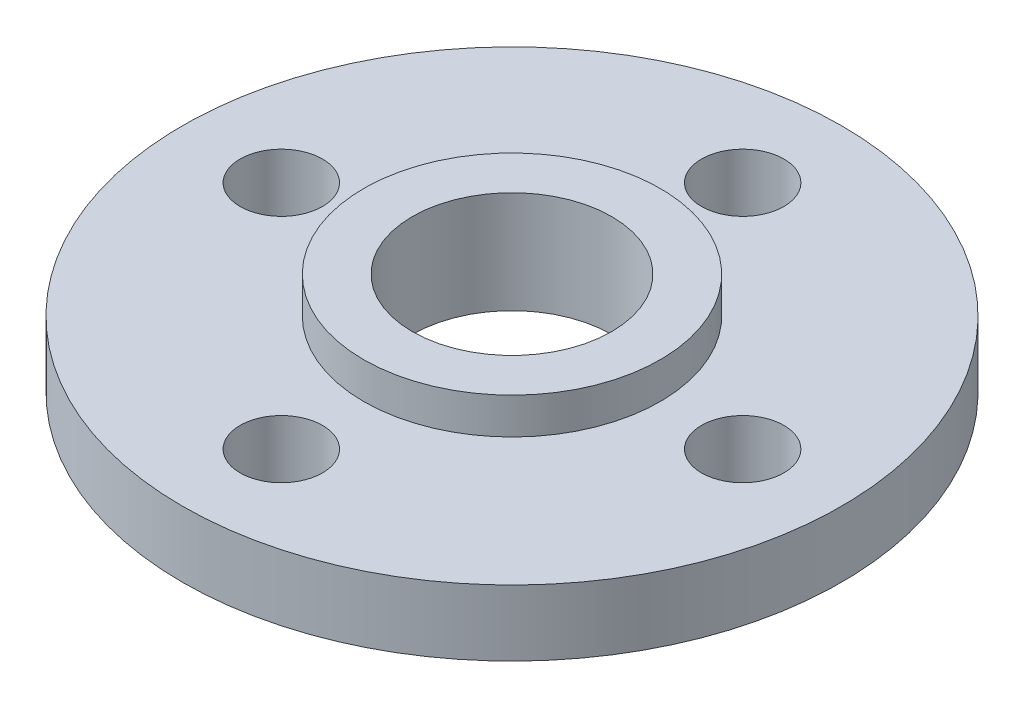
from build123d import *

# Parameters (mm, degrees)
SKETCH_1_R          = 10
EXTRUDE_1_DEPTH     = 2
SKETCH_2_R          = 4.5
EXTRUDE_2_DEPTH     = 1.1
CUT_EXTRUDE_1_REACH = 16.478
SKETCH_3_R          = 3.025
CUT_EXTRUDE_2_REACH = 16.283
SKETCH_4_R          = 1.25


with BuildPart() as part:
    # 草图1 → 凸台-拉伸1 (new body)
    with BuildSketch(Plane(origin=(0, 0, 0), x_dir=(1, 0, 0), z_dir=(0, 1, 0))):
        with Locations(Location((0, 0, 0), (0, 0, 270))):
            Circle(SKETCH_1_R)
    extrude(amount=EXTRUDE_1_DEPTH)

    # 草图2 → 凸台-拉伸2 (add)
    with BuildSketch(Plane(origin=(0, 2, 0), x_dir=(1, 0, 0), z_dir=(0, 1, 0))):
        with Locations(Location((0, 0, 0), (0, 0, 270))):
            Circle(SKETCH_2_R)
    extrude(amount=EXTRUDE_2_DEPTH)

    # 草图3 → 切除-拉伸1 (cut, up to next)
    with BuildSketch(Plane(origin=(0, 3.1, 0), x_dir=(1, 0, 0), z_dir=(0, 1, 0)), mode=Mode.PRIVATE) as cut_extrude_1_sk1:
        with Locations(Location((0, 0, 0), (0, 0, 270))):
            Circle(SKETCH_3_R)
    cut_extrude_1_tool1 = extrude(cut_extrude_1_sk1.sketch, amount=-CUT_EXTRUDE_1_REACH, mode=Mode.PRIVATE) & part.part
    add(cut_extrude_1_tool1.solids().sort_by_distance((0, 3.1, 0))[0], mode=Mode.SUBTRACT)

    # 草图4 → 切除-拉伸2 (cut, up to next)
    with BuildSketch(Plane(origin=(0, 2, 0), x_dir=(1, 0, 0), z_dir=(0, 1, 0)), mode=Mode.PRIVATE) as cut_extrude_2_sk1:
        with Locations(Location((0, 7, 0), (0, 0, 270))):
            Circle(SKETCH_4_R)
    cut_extrude_2_tool1 = extrude(cut_extrude_2_sk1.sketch, amount=-CUT_EXTRUDE_2_REACH, mode=Mode.PRIVATE) & part.part
    # 草图4 → 切除-拉伸2 (cut, up to next)
    with BuildSketch(Plane(origin=(0, 2, 0), x_dir=(1, 0, 0), z_dir=(0, 1, 0)), mode=Mode.PRIVATE) as cut_extrude_2_sk2:
        with Locations(Location((7, 0, 0), (0, 0, 270))):
            Circle(SKETCH_4_R)
    cut_extrude_2_tool2 = extrude(cut_extrude_2_sk2.sketch, amount=-CUT_EXTRUDE_2_REACH, mode=Mode.PRIVATE) & part.part
    # 草图4 → 切除-拉伸2 (cut, up to next)
    with BuildSketch(Plane(origin=(0, 2, 0), x_dir=(1, 0, 0), z_dir=(0, 1, 0)), mode=Mode.PRIVATE) as cut_extrude_2_sk3:
        with Locations(Location((0, -7, 0), (0, 0, 270))):
            Circle(SKETCH_4_R)
    cut_extrude_2_tool3 = extrude(cut_extrude_2_sk3.sketch, amount=-CUT_EXTRUDE_2_REACH, mode=Mode.PRIVATE) & part.part
    # 草图4 → 切除-拉伸2 (cut, up to next)
    with BuildSketch(Plane(origin=(0, 2, 0), x_dir=(1, 0, 0), z_dir=(0, 1, 0)), mode=Mode.PRIVATE) as cut_extrude_2_sk4:
        with Locations(Location((-7, 0, 0), (0, 0, 270))):
            Circle(SKETCH_4_R)
    cut_extrude_2_tool4 = extrude(cut_extrude_2_sk4.sketch, amount=-CUT_EXTRUDE_2_REACH, mode=Mode.PRIVATE) & part.part
    add(cut_extrude_2_tool1.solids().sort_by_distance((0, 2, -7))[0], mode=Mode.SUBTRACT)
    add(cut_extrude_2_tool2.solids().sort_by_distance((7, 2, 0))[0], mode=Mode.SUBTRACT)
    add(cut_extrude_2_tool3.solids().sort_by_distance((0, 2, 7))[0], mode=Mode.SUBTRACT)
    add(cut_extrude_2_tool4.solids().sort_by_distance((-7, 2, 0))[0], mode=Mode.SUBTRACT)


solid = part.part
